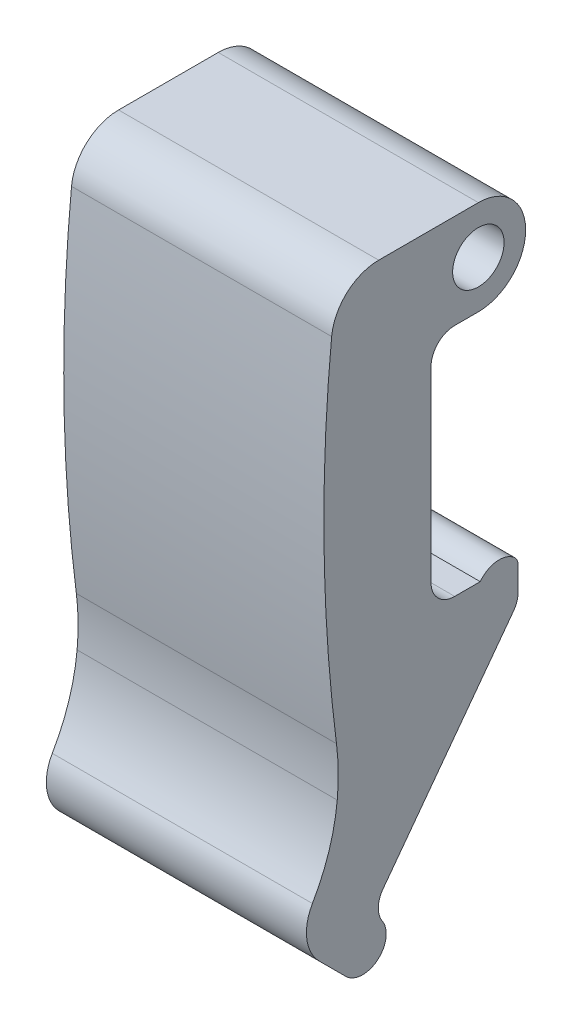
from build123d import *

# Parameters (mm, degrees)
EXTRUDE1_DEPTH              = 8.73125
FILLET1_R                   = 3.175
FILLET2_R                   = 1.5875
FILLET3_R                   = 12.7
FILLET5_R                   = 0.79375
F_29_0_136_DIAMETER_HOLE1_D = 3.4544


with BuildPart() as part:
    # Sketch1 → Extrude1 (new, symmetric)
    with BuildSketch(Plane(origin=(0, 0, 0), x_dir=(0, 0, -1), z_dir=(1, 0, 0))):
        with BuildLine():
            Line((0, 3.175), (-9.525, 3.175))
            ThreePointArc((-9.525, 3.175), (-10.371241591, -10.169917472), (-9.525, -23.514834943))
            ThreePointArc((-9.525, -23.514834943), (-9.557235696, -27.523032937), (-10.655093305, -31.378081441))
            ThreePointArc((-10.655093305, -31.378081441), (-11.542308189, -33.477423108), (-10.675148068, -35.585127786))
            Line((-10.675148068, -35.585127786), (-9.43326403, -36.827011824))
            Line((-9.43326403, -36.827011824), (-8.894448663, -37.365827191))
            ThreePointArc((-8.894448663, -37.365827191), (-6.649384633, -37.365827191), (-6.649384633, -35.120763161))
            Line((-6.649384633, -35.120763161), (-7.1882, -34.581947794))
            Line((-7.1882, -34.581947794), (2.667, -21.336))
            Line((2.667, -21.336), (2.667, -18.923))
            ThreePointArc((2.667, -18.923), (1.397, -18.288), (0.127, -18.923))
            Line((0.127, -18.923), (-3.175, -18.923))
            Line((-3.175, -18.923), (-3.175, -3.175))
            Line((-3.175, -3.175), (0, -3.175))
            ThreePointArc((0, -3.175), (3.175, 0), (0, 3.175))
        make_face()
    extrude(amount=EXTRUDE1_DEPTH, both=True)

    # Fillet1
    fillet1_edges = [part.edges().sort_by_distance(p)[0] for p in [
        (0, 3.175, 9.525),
    ]]
    fillet(fillet1_edges, radius=FILLET1_R)

    # Fillet2
    fillet2_edges = [part.edges().sort_by_distance(p)[0] for p in [
        (0, -3.175, 3.175),
        (0, -34.581947794, 7.1882),
        (0, -21.336, -2.667),
        (0, -18.923, 3.175),
    ]]
    fillet(fillet2_edges, radius=FILLET2_R)

    # Fillet3
    fillet3_edges = [part.edges().sort_by_distance(p)[0] for p in [
        (0, -31.378081441, 10.655093305),
    ]]
    fillet(fillet3_edges, radius=FILLET3_R)

    # Fillet5
    fillet5_edges = [part.edges().sort_by_distance(p)[0] for p in [
        (0, -18.923, -2.667),
    ]]
    fillet(fillet5_edges, radius=FILLET5_R)

    # #29 (0.136) Diameter Hole1 (through all)
    with Locations(Plane(origin=(8.73125, 0, 0), x_dir=(0, 0, -1), z_dir=(1, 0, 0))):
        with Locations((0, 0)):
            Hole(F_29_0_136_DIAMETER_HOLE1_D / 2)


solid = part.part
